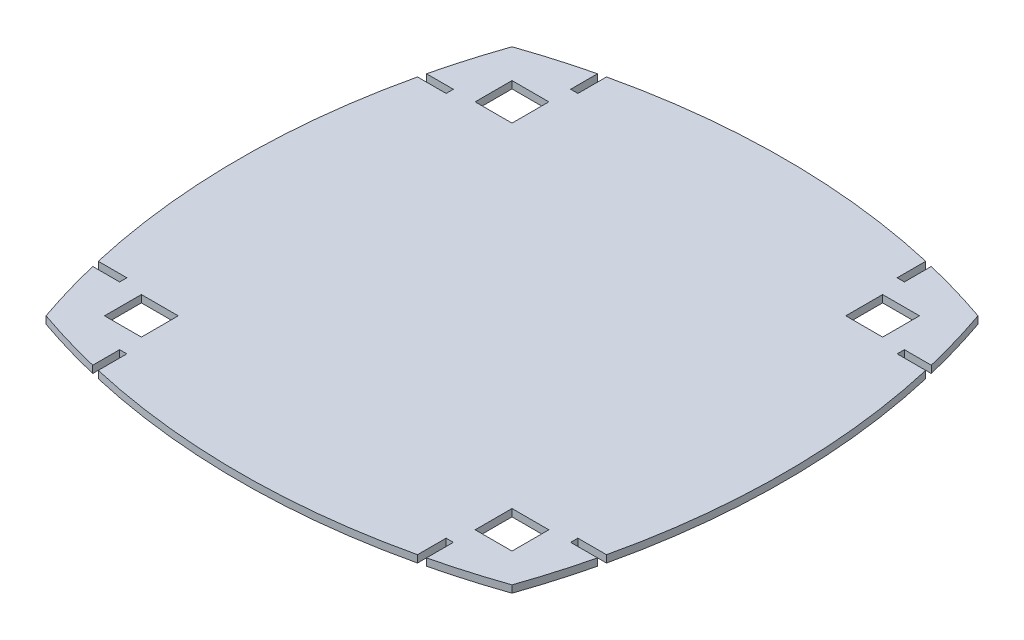
from build123d import *

# Parameters (mm, degrees)
SKETCH1_W           = 25.4
SKETCH1_H           = 25.4
BOSS_EXTRUDE1_DEPTH = 5


with BuildPart() as part:
    # Sketch1 → Boss-Extrude1 (new body)
    with BuildSketch(Plane(origin=(0, 0, 0), x_dir=(1, 0, 0), z_dir=(0, 1, 0))):
        with BuildLine():
            Line((110, 155.4), (110, 175.11258305))
            ThreePointArc((110, 175.11258305), (0, 187.619127597), (-110, 175.11258305))
            Line((-110, 175.11258305), (-110, 155.4))
            Line((-110, 155.4), (-115, 155.4))
            Line((-115, 155.4), (-115, 173.933099678))
            ThreePointArc((-115, 173.933099678), (-137.944531709, 167.801332887), (-160.565, 160.565))
            ThreePointArc((-160.565, 160.565), (-167.801332887, 137.944531709), (-173.933099678, 115))
            Line((-173.933099678, 115), (-155.4, 115))
            Line((-155.4, 115), (-155.4, 110))
            Line((-155.4, 110), (-175.11258305, 110))
            ThreePointArc((-175.11258305, 110), (-187.619127597, 0), (-175.11258305, -110))
            Line((-175.11258305, -110), (-155.4, -110))
            Line((-155.4, -110), (-155.4, -115))
            Line((-155.4, -115), (-173.933099678, -115))
            ThreePointArc((-173.933099678, -115), (-167.801332887, -137.944531709), (-160.565, -160.565))
            ThreePointArc((-160.565, -160.565), (-137.944531709, -167.801332887), (-115, -173.933099678))
            Line((-115, -173.933099678), (-115, -155.4))
            Line((-115, -155.4), (-110, -155.4))
            Line((-110, -155.4), (-110, -175.11258305))
            ThreePointArc((-110, -175.11258305), (0, -187.619127597), (110, -175.11258305))
            Line((110, -175.11258305), (110, -155.4))
            Line((110, -155.4), (115, -155.4))
            Line((115, -155.4), (115, -173.933099678))
            ThreePointArc((115, -173.933099678), (137.944531709, -167.801332887), (160.565, -160.565))
            ThreePointArc((160.565, -160.565), (167.801332887, -137.944531709), (173.933099678, -115))
            Line((173.933099678, -115), (155.4, -115))
            Line((155.4, -115), (155.4, -110))
            Line((155.4, -110), (175.11258305, -110))
            ThreePointArc((175.11258305, -110), (187.619127597, 0), (175.11258305, 110))
            Line((175.11258305, 110), (155.4, 110))
            Line((155.4, 110), (155.4, 115))
            Line((155.4, 115), (173.933099678, 115))
            ThreePointArc((173.933099678, 115), (167.801332887, 137.944531709), (160.565, 160.565))
            ThreePointArc((160.565, 160.565), (137.944531709, 167.801332887), (115, 173.933099678))
            Line((115, 173.933099678), (115, 155.4))
            Line((115, 155.4), (110, 155.4))
        make_face()
        with Locations((-127.7, 127.7)):
            Rectangle(SKETCH1_W, SKETCH1_H, mode=Mode.SUBTRACT)
        with Locations((127.7, 127.7)):
            Rectangle(SKETCH1_W, SKETCH1_H, mode=Mode.SUBTRACT)
        with Locations((127.7, -127.7)):
            Rectangle(SKETCH1_W, SKETCH1_H, mode=Mode.SUBTRACT)
        with Locations((-127.7, -127.7)):
            Rectangle(SKETCH1_W, SKETCH1_H, mode=Mode.SUBTRACT)
    extrude(amount=BOSS_EXTRUDE1_DEPTH)


solid = part.part
